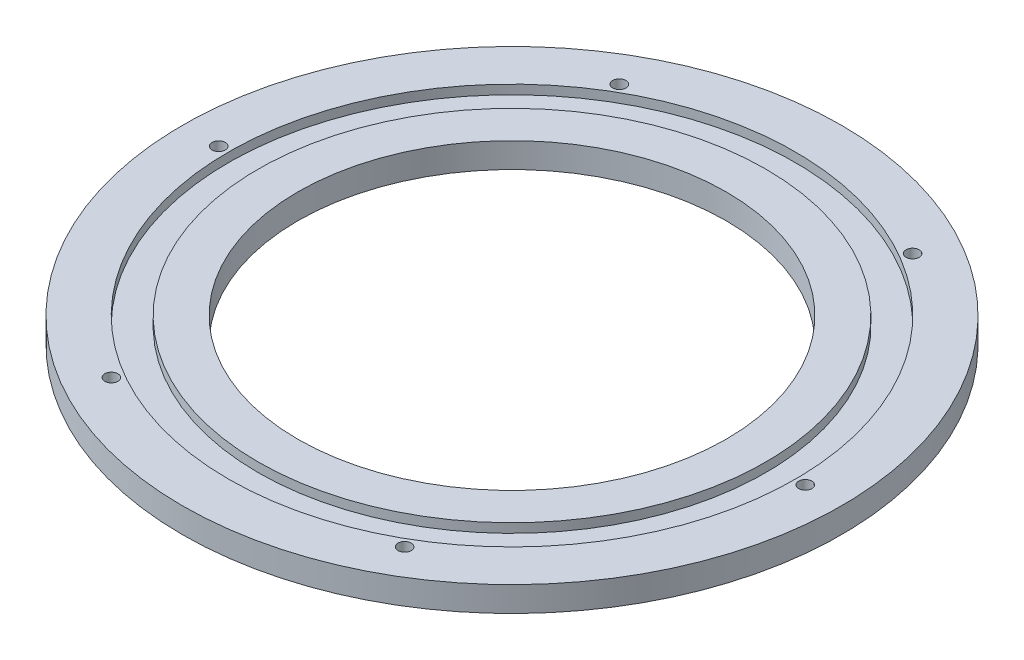
from build123d import *

# Parameters (mm, degrees)
SKETCH1_R           = 250
SKETCH1_R_2         = 162.5
BOSS_EXTRUDE1_DEPTH = 19
SKETCH2_R           = 215
SKETCH2_R_2         = 192.5
CUT_EXTRUDE1_DEPTH  = 7
SKETCH3_R           = 5
CUT_EXTRUDE2_DEPTH  = 355.063553617


with BuildPart() as part:
    # Sketch1 → Boss-Extrude1 (new body)
    with BuildSketch(Plane(origin=(0, 0, 0), x_dir=(1, 0, 0), z_dir=(0, 1, 0))):
        with Locations(Location((0, 0, 0), (0, 0, 270))):
            Circle(SKETCH1_R)
        with Locations(Location((0, 0, 0), (0, 0, 270))):
            Circle(SKETCH1_R_2, mode=Mode.SUBTRACT)
    extrude(amount=BOSS_EXTRUDE1_DEPTH)

    # Sketch2 → Cut-Extrude1 (cut)
    with BuildSketch(Plane(origin=(0, 19, 0), x_dir=(1, 0, 0), z_dir=(0, 1, 0))):
        with Locations(Location((0, 0, 0), (0, 0, 270))):
            Circle(SKETCH2_R)
        with Locations(Location((0, 0, 0), (0, 0, 270))):
            Circle(SKETCH2_R_2, mode=Mode.SUBTRACT)
    extrude(amount=-CUT_EXTRUDE1_DEPTH, mode=Mode.SUBTRACT)

    # Sketch3 → Cut-Extrude2 (cut, through all)
    with BuildSketch(Plane.XZ):
        with Locations(Location((111.25, 192.690652342, 0), (0, 0, 270))):
            Circle(SKETCH3_R)
        with Locations(Location((222.5, 0, 0), (0, 0, 270))):
            Circle(SKETCH3_R)
        with Locations(Location((-222.5, 0, 0), (0, 0, 90))):
            Circle(SKETCH3_R)
        with Locations(Location((-111.25, 192.690652342, 0), (0, 0, 90))):
            Circle(SKETCH3_R)
        with Locations(Location((111.25, -192.690652342, 0), (0, 0, 90))):
            Circle(SKETCH3_R)
        with Locations(Location((-111.25, -192.690652342, 0), (0, 0, 270))):
            Circle(SKETCH3_R)
    extrude(amount=-CUT_EXTRUDE2_DEPTH, mode=Mode.SUBTRACT)


solid = part.part
